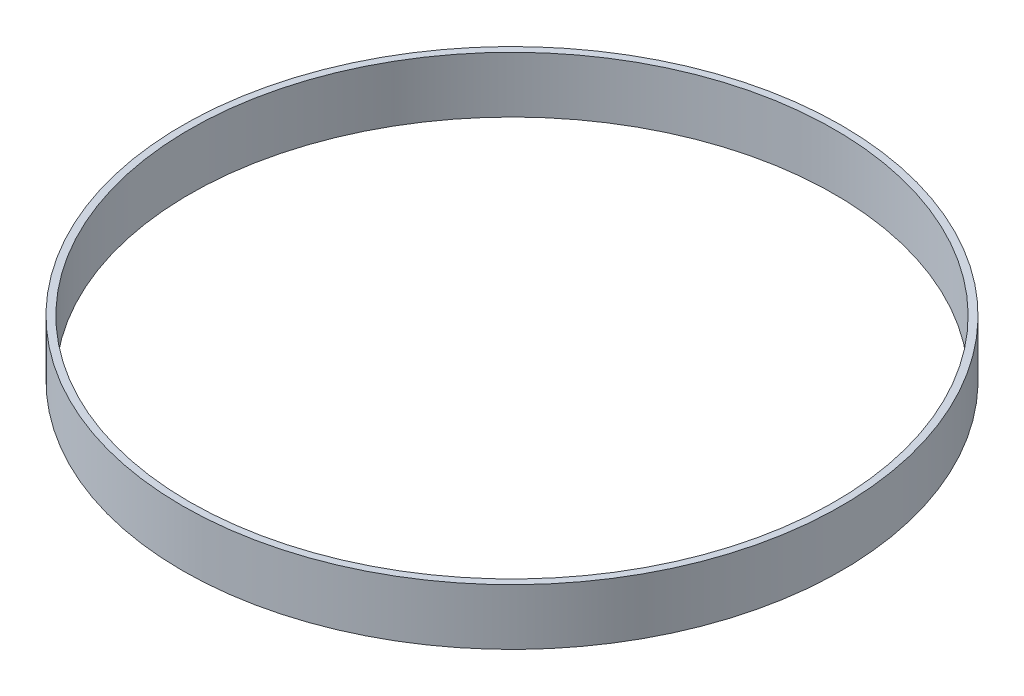
from build123d import *

# Parameters (mm, degrees)
ESQUISSE1_R        = 47
ESQUISSE1_R_2      = 46
BOSS_EXTRU_1_DEPTH = 8


with BuildPart() as part:
    # Esquisse1 → Boss.-Extru.1 (new body)
    with BuildSketch(Plane(origin=(0, 0, 0), x_dir=(1, 0, 0), z_dir=(0, 1, 0))):
        with Locations(Location((0, 0, 0), (0, 0, 270))):
            Circle(ESQUISSE1_R)
        with Locations(Location((0, 0, 0), (0, 0, 270))):
            Circle(ESQUISSE1_R_2, mode=Mode.SUBTRACT)
    extrude(amount=BOSS_EXTRU_1_DEPTH)


solid = part.part
